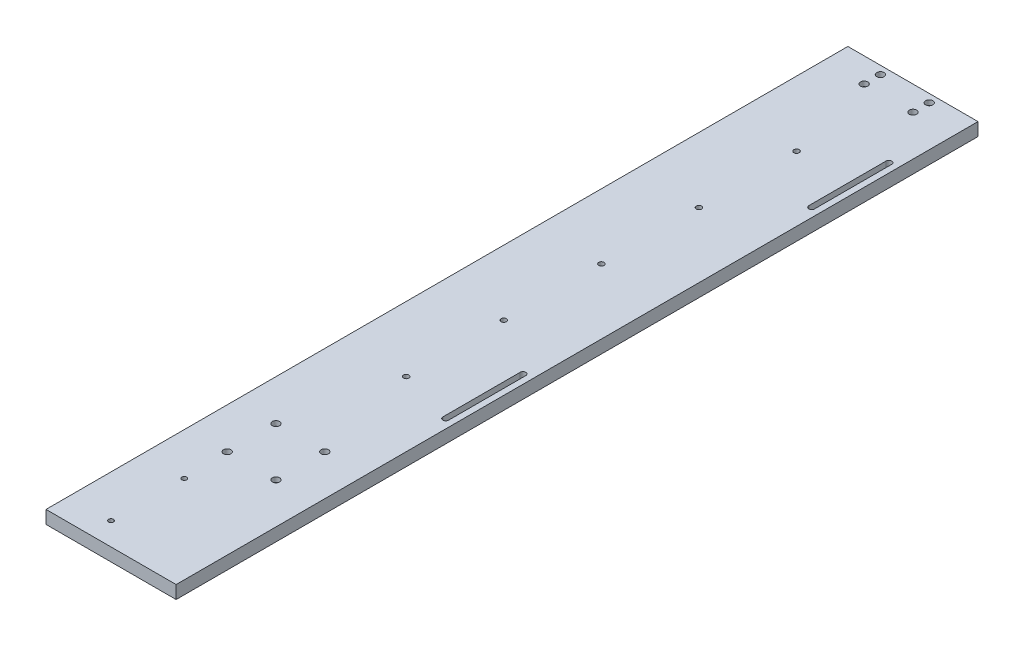
from build123d import *

# Parameters (mm, degrees)
SKETCH_1_W                  = 80
SKETCH_1_H                  = 8
EXTRUDE_1_DEPTH             = 1000
SKETCH_3_R                  = 4
CUT_EXTRUDE_1_DEPTH         = 5
SKETCH_4_R                  = 2.25
CUT_EXTRUDE_2_DEPTH         = 5
SKETCH_5_R                  = 2.25
CUT_EXTRUDE_3_DEPTH         = 8
PATTERN_LINEAR_1_COUNT      = 2
PATTERN_LINEAR_1_PITCH      = 30
PATTERN_LINEAR_1_COUNT_DIR2 = 2
PATTERN_LINEAR_1_PITCH_DIR2 = 30
SKETCH_6_R                  = 4
CUT_EXTRUDE_4_DEPTH         = 5
PATTERN_LINEAR_2_COUNT      = 2
PATTERN_LINEAR_2_PITCH      = 30
PATTERN_LINEAR_2_COUNT_DIR2 = 2
PATTERN_LINEAR_2_PITCH_DIR2 = 30
PATTERN_LINEAR_11_COUNT     = 2
PATTERN_LINEAR_11_PITCH     = 10
CUT_EXTRUDE_8_DEPTH         = 4
CUT_EXTRUDE_9_DEPTH         = 5
PATTERN_LINEAR_5_COUNT      = 2
PATTERN_LINEAR_5_PITCH      = 610
PATTERN_LINEAR_6_COUNT      = 2
PATTERN_LINEAR_6_PITCH      = 225
PATTERN_LINEAR_7_COUNT      = 2
PATTERN_LINEAR_7_PITCH      = 385
SKETCH_13_R                 = 1.5
CUT_EXTRUDE_10_DEPTH        = 8
SKETCH_14_R                 = 3
CUT_EXTRUDE_11_DEPTH        = 4
PATTERN_LINEAR_8_COUNT      = 2
PATTERN_LINEAR_8_PITCH      = 927
SKETCH_15_R                 = 1.65
CUT_EXTRUDE_12_DEPTH        = 10
PATTERN_LINEAR_9_COUNT      = 5
PATTERN_LINEAR_9_PITCH      = 60
SKETCH_16_R                 = 1.65
CUT_EXTRUDE_13_DEPTH        = 10
PATTERN_LINEAR_10_COUNT     = 5
PATTERN_LINEAR_10_PITCH     = 60
SKETCH_17_W                 = 80
SKETCH_17_H                 = 507
CUT_EXTRUDE_14_DEPTH        = 10


with BuildPart() as part:
    # Эскиз1 → Бобышка-Вытянуть1 (new body)
    with BuildSketch(Plane.XY):
        Rectangle(SKETCH_1_W, SKETCH_1_H)
    extrude(amount=EXTRUDE_1_DEPTH)

    # Эскиз3 → Вырез-Вытянуть1 (cut)
    with BuildSketch(Plane.XZ.offset(4)):
        with Locations(Location((15, 512, 0), (0, 0, 270))):
            Circle(SKETCH_3_R)
        with Locations(Location((-15, 512, 0), (0, 0, 270))):
            Circle(SKETCH_3_R)
    cut_extrude_1 = extrude(amount=-CUT_EXTRUDE_1_DEPTH, mode=Mode.SUBTRACT)

    # Эскиз4 → Вырез-Вытянуть2 (cut)
    with BuildSketch(Plane.XZ.offset(-1)):
        with Locations(Location((-15, 512, 0), (0, 0, 270))):
            Circle(SKETCH_4_R)
        with Locations(Location((15, 512, 0), (0, 0, 270))):
            Circle(SKETCH_4_R)
    cut_extrude_2 = extrude(amount=-CUT_EXTRUDE_2_DEPTH, mode=Mode.SUBTRACT)

    # Эскиз5 → Вырез-Вытянуть3 (cut)
    with BuildSketch(Plane.XZ.offset(4)):
        with Locations(Location((-15, 913.6, 0), (0, 0, 270))):
            Circle(SKETCH_5_R)
    cut_extrude_3 = extrude(amount=-CUT_EXTRUDE_3_DEPTH, mode=Mode.SUBTRACT)

    # Линейный массив1: Cut-Extrude 3 2 × 2
    with Locations(*[(i * PATTERN_LINEAR_1_PITCH, 0, -j * PATTERN_LINEAR_1_PITCH_DIR2) for i in range(PATTERN_LINEAR_1_COUNT) for j in range(PATTERN_LINEAR_1_COUNT_DIR2) if (i, j) != (0, 0)]):
        add(cut_extrude_3, mode=Mode.SUBTRACT)

    # Эскиз6 → Вырез-Вытянуть4 (cut)
    with BuildSketch(Plane.XZ.offset(4)):
        with Locations(Location((-15, 913.6, 0), (0, 0, 270))):
            Circle(SKETCH_6_R)
    cut_extrude_4 = extrude(amount=-CUT_EXTRUDE_4_DEPTH, mode=Mode.SUBTRACT)

    # Линейный массив2: Cut-Extrude 4 2 × 2
    with Locations(*[(i * PATTERN_LINEAR_2_PITCH, 0, -j * PATTERN_LINEAR_2_PITCH_DIR2) for i in range(PATTERN_LINEAR_2_COUNT) for j in range(PATTERN_LINEAR_2_COUNT_DIR2) if (i, j) != (0, 0)]):
        add(cut_extrude_4, mode=Mode.SUBTRACT)

    # Линейный массив11: Вырез-Вытянуть1, Вырез-Вытянуть2 ×2
    with Locations(*[(0, 0, i * PATTERN_LINEAR_11_PITCH) for i in range(1, PATTERN_LINEAR_11_COUNT)]):
        add(cut_extrude_1, mode=Mode.SUBTRACT)
        add(cut_extrude_2, mode=Mode.SUBTRACT)

    # Эскиз11 → Вырез-Вытянуть8 (cut)
    with BuildSketch(Plane.XZ.offset(4)):
        with BuildLine():
            Line((37.5, 220), (37.5, 170))
            ThreePointArc((37.5, 170), (34.5, 167), (31.5, 170))
            Line((31.5, 170), (31.5, 220))
            ThreePointArc((31.5, 220), (34.5, 223), (37.5, 220))
        make_face()
    cut_extrude_8 = extrude(amount=-CUT_EXTRUDE_8_DEPTH, mode=Mode.SUBTRACT)

    # Эскиз12 → Вырез-Вытянуть9 (cut)
    with BuildSketch(Plane(origin=(0, 0, 0), x_dir=(-1, 0, 0), z_dir=(0, -1, 0))):
        with BuildLine():
            Line((-36.25, -218.75), (-36.25, -171.25))
            ThreePointArc((-36.25, -171.25), (-34.5, -169.5), (-32.75, -171.25))
            Line((-32.75, -171.25), (-32.75, -218.75))
            ThreePointArc((-32.75, -218.75), (-34.5, -220.5), (-36.25, -218.75))
        make_face()
    cut_extrude_9 = extrude(amount=-CUT_EXTRUDE_9_DEPTH, mode=Mode.SUBTRACT)

    # Линейный массив5: Вырез-Вытянуть8, Вырез-Вытянуть9 ×2
    with Locations(*[(0, 0, i * PATTERN_LINEAR_5_PITCH) for i in range(1, PATTERN_LINEAR_5_COUNT)]):
        add(cut_extrude_8, mode=Mode.SUBTRACT)
        add(cut_extrude_9, mode=Mode.SUBTRACT)

    # Линейный массив6: Вырез-Вытянуть8, Вырез-Вытянуть9 ×2
    with Locations(*[(0, 0, i * PATTERN_LINEAR_6_PITCH) for i in range(1, PATTERN_LINEAR_6_COUNT)]):
        add(cut_extrude_8, mode=Mode.SUBTRACT)
        add(cut_extrude_9, mode=Mode.SUBTRACT)

    # Линейный массив7: Вырез-Вытянуть8, Вырез-Вытянуть9 ×2
    with Locations(*[(0, 0, i * PATTERN_LINEAR_7_PITCH) for i in range(1, PATTERN_LINEAR_7_COUNT)]):
        add(cut_extrude_8, mode=Mode.SUBTRACT)
        add(cut_extrude_9, mode=Mode.SUBTRACT)

    # Эскиз13 → Вырез-Вытянуть10 (cut)
    with BuildSketch(Plane.XZ.offset(4)):
        with Locations(Location((-14, 59, 0), (0, 0, 270))):
            Circle(SKETCH_13_R)
        with Locations(Location((-14, 14, 0), (0, 0, 270))):
            Circle(SKETCH_13_R)
    cut_extrude_10 = extrude(amount=-CUT_EXTRUDE_10_DEPTH, mode=Mode.SUBTRACT)

    # Эскиз14 → Вырез-Вытянуть11 (cut)
    with BuildSketch(Plane.XZ.offset(4)):
        with Locations(Location((-14, 59, 0), (0, 0, 270))):
            Circle(SKETCH_14_R)
        with Locations(Location((-14, 14, 0), (0, 0, 270))):
            Circle(SKETCH_14_R)
    cut_extrude_11 = extrude(amount=-CUT_EXTRUDE_11_DEPTH, mode=Mode.SUBTRACT)

    # Линейный массив8: Вырез-Вытянуть10, Вырез-Вытянуть11 ×2
    with Locations(*[(0, 0, i * PATTERN_LINEAR_8_PITCH) for i in range(1, PATTERN_LINEAR_8_COUNT)]):
        add(cut_extrude_10, mode=Mode.SUBTRACT)
        add(cut_extrude_11, mode=Mode.SUBTRACT)

    # Эскиз15 → Вырез-Вытянуть12 (cut)
    with BuildSketch(Plane.XZ.offset(4)):
        with Locations(Location((0, 421.45, 0), (0, 0, 270))):
            Circle(SKETCH_15_R)
    cut_extrude_12 = extrude(amount=-CUT_EXTRUDE_12_DEPTH, mode=Mode.SUBTRACT)

    # Линейный массив9: Вырез-Вытянуть12 ×5
    with Locations(*[(0, 0, -i * PATTERN_LINEAR_9_PITCH) for i in range(1, PATTERN_LINEAR_9_COUNT)]):
        add(cut_extrude_12, mode=Mode.SUBTRACT)

    # Эскиз16 → Вырез-Вытянуть13 (cut)
    with BuildSketch(Plane.XZ.offset(4)):
        with Locations(Location((0, 578.55, 0), (0, 0, 270))):
            Circle(SKETCH_16_R)
    cut_extrude_13 = extrude(amount=-CUT_EXTRUDE_13_DEPTH, mode=Mode.SUBTRACT)

    # Линейный массив10: Вырез-Вытянуть13 ×5
    with Locations(*[(0, 0, i * PATTERN_LINEAR_10_PITCH) for i in range(1, PATTERN_LINEAR_10_COUNT)]):
        add(cut_extrude_13, mode=Mode.SUBTRACT)

    # Эскиз17 → Вырез-Вытянуть14 (cut)
    with BuildSketch(Plane.XZ.offset(4)):
        with Locations((0, 253.5)):
            Rectangle(SKETCH_17_W, SKETCH_17_H)
    extrude(amount=-CUT_EXTRUDE_14_DEPTH, mode=Mode.SUBTRACT)


solid = part.part
